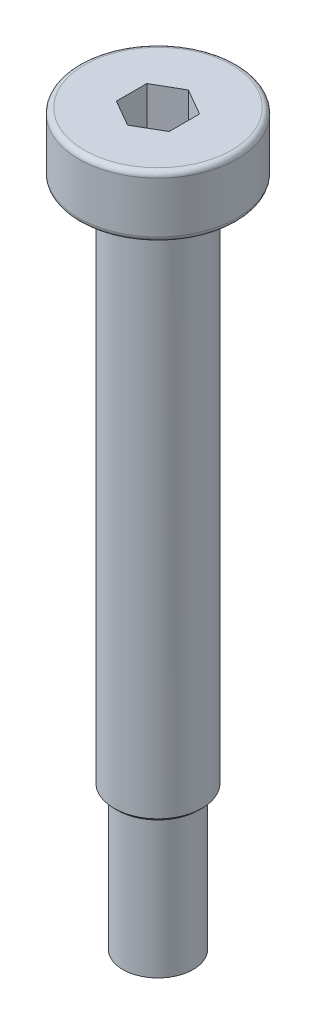
from build123d import *

# Parameters (mm, degrees)
FILLET_1_R          = 0.3
CUT_EXTRUDE_1_DEPTH = 2.4
CHAMFER_1_SIZE      = 0.2


with BuildPart() as part:
    # 草图1 → 旋转1 (revolve)
    with BuildSketch(Plane.XY):
        Polygon((0, 3.5), (-4.5, 3.5), (-4.5, 0), (-2.5, 0), (-2.5, -30), (-2, -30), (-2, -38), (0, -38), align=None)
    revolve(axis=Axis((0, 3.5, 0), (0, -1, 0)))

    # 圆角1
    fillet_1_edges = [part.edges().sort_by_distance(p)[0] for p in [
        (4.5, 0, 0),
        (4.5, 3.5, 0),
    ]]
    fillet(fillet_1_edges, radius=FILLET_1_R)

    # 草图2 → 切除-拉伸1 (cut)
    with BuildSketch(Plane(origin=(0, 3.5, 0), x_dir=(1, 0, 0), z_dir=(0, 1, 0))):
        Polygon((0, 1.732050808), (-1.5, 0.866025404), (-1.5, -0.866025404), (0, -1.732050808), (1.5, -0.866025404), (1.5, 0.866025404), align=None)
    extrude(amount=-CUT_EXTRUDE_1_DEPTH, mode=Mode.SUBTRACT)

    # 倒角1
    chamfer_1_edges = [part.edges().sort_by_distance(p)[0] for p in [
        (2.5, -30, 0),
    ]]
    chamfer(chamfer_1_edges, length=CHAMFER_1_SIZE)


solid = part.part
